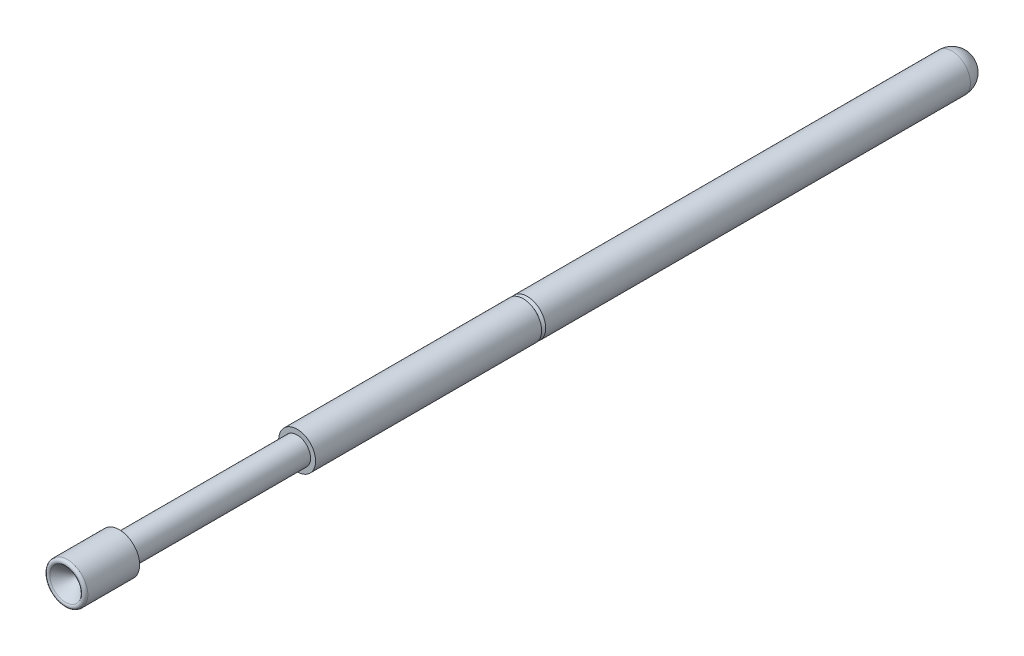
from build123d import *


with BuildPart() as part:
    # Эскиз1 → Повернуть1 (revolve)
    with BuildSketch(Plane(origin=(0, 0, 0), x_dir=(1, 0, 0), z_dir=(0, 1, 0))):
        with BuildLine():
            Line((0, 0), (0, -32.749033403))
            Line((0, -32.749033403), (-0.579289322, -33.328322725))
            ThreePointArc((-0.579289322, -33.328322725), (-0.688268343, -33.35), (-0.75, -33.257612047))
            Line((-0.75, -33.257612047), (-0.75, -31.35))
            Line((-0.75, -31.35), (-0.495, -31.35))
            Line((-0.495, -31.35), (-0.495, -24.8))
            Line((-0.495, -24.8), (-0.68, -24.8))
            Line((-0.68, -24.8), (-0.68, -16.475))
            Line((-0.68, -16.475), (-0.579289322, -16.4))
            Line((-0.579289322, -16.4), (-0.68, -16.325))
            Line((-0.68, -16.325), (-0.68, -0.68))
            ThreePointArc((-0.68, -0.68), (-0.480832611, -0.199167389), (0, 0))
        make_face()
    revolve(axis=Axis((0, 0, 0), (0, 0, 1)))


solid = part.part
